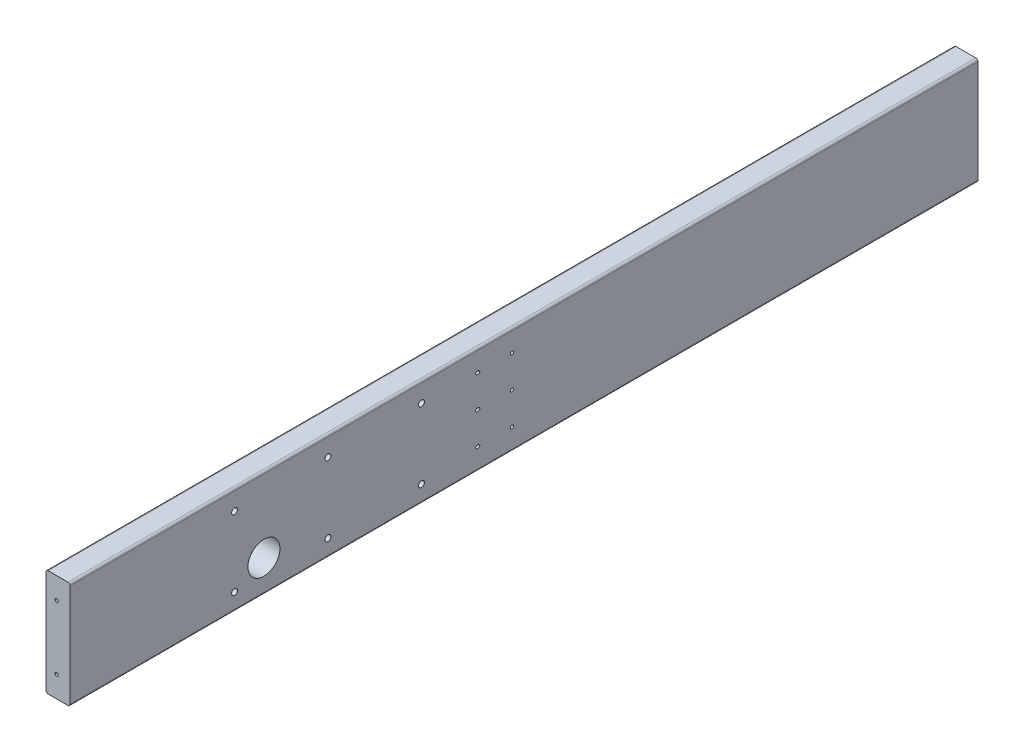
from build123d import *

# Parameters (mm, degrees)
SKETCH1_W                       = 45
SKETCH1_H                       = 200
BOSS_EXTRUDE1_DEPTH             = 1700
FILLET1_R                       = 4
SKETCH9_R                       = 30
CUT_EXTRUDE1_DEPTH              = 50
SKETCH10_R                      = 5.5
CUT_EXTRUDE2_DEPTH              = 50
SKETCH11_R                      = 5.5
CUT_EXTRUDE3_DEPTH              = 50
SKETCH12_R                      = 5.5
CUT_EXTRUDE4_DEPTH              = 50
SKETCH13_R                      = 5.5
CUT_EXTRUDE5_DEPTH              = 50
SKETCH14_R                      = 5.5
CUT_EXTRUDE6_DEPTH              = 50
SKETCH15_R                      = 5.5
CUT_EXTRUDE7_DEPTH              = 50
SKETCH16_R                      = 18
CUT_EXTRUDE8_DEPTH              = 30
F_6_0MM_DOWEL_SLOT_D            = 6
F_6_0MM_DOWEL_SLOT_DEPTH        = 128.197418143
F_6_0MM_DOWEL_SLOT_CSINK_D      = 6.05
F_6_0MM_DOWEL_SLOT_CSINK_ANGLE  = 90
F_6_0MM_DOWEL_SLOT_TIP          = 1.802581857
F_6_0MM_DOWEL_SLOT1_D           = 6
F_6_0MM_DOWEL_SLOT1_DEPTH       = 63.197418143
F_6_0MM_DOWEL_SLOT1_CSINK_D     = 6.05
F_6_0MM_DOWEL_SLOT1_CSINK_ANGLE = 90
F_6_0MM_DOWEL_SLOT1_TIP         = 1.802581857
SKETCH25_R                      = 18
CUT_EXTRUDE9_DEPTH              = 30
F_6_0MM_DOWEL_SLOT2_D           = 6
F_6_0MM_DOWEL_SLOT2_DEPTH       = 48.197418143
F_6_0MM_DOWEL_SLOT2_CSINK_D     = 6.05
F_6_0MM_DOWEL_SLOT2_CSINK_ANGLE = 90
F_6_0MM_DOWEL_SLOT2_TIP         = 1.802581857
F_8_0MM_DOWEL_SLOT4_D           = 8
F_8_0MM_DOWEL_SLOT4_DEPTH       = 137.596557524
F_8_0MM_DOWEL_SLOT4_CSINK_D     = 8.05
F_8_0MM_DOWEL_SLOT4_CSINK_ANGLE = 90
F_8_0MM_DOWEL_SLOT4_TIP         = 2.403442476


with BuildPart() as part:
    # Sketch1 → Boss-Extrude1 (new body)
    with BuildSketch(Plane.XY):
        with Locations((-8.688255411, 34.272684877)):
            Rectangle(SKETCH1_W, SKETCH1_H)
    extrude(amount=BOSS_EXTRUDE1_DEPTH)

    # Fillet1
    fillet1_edges = [part.edges().sort_by_distance(p)[0] for p in [
        (13.811744589, 134.272684877, 850),
        (13.811744589, -65.727315123, 850),
        (-31.188255411, -65.727315123, 850),
        (-31.188255411, 134.272684877, 850),
    ]]
    fillet(fillet1_edges, radius=FILLET1_R)

    # Sketch9 → Cut-Extrude1 (cut)
    with BuildSketch(Plane(origin=(13.811744589, 0, 0), x_dir=(0, 0, -1), z_dir=(1, 0, 0))):
        with Locations((-1337, -5.727315122)):
            Circle(SKETCH9_R)
    extrude(amount=-CUT_EXTRUDE1_DEPTH, mode=Mode.SUBTRACT)

    # Sketch10 → Cut-Extrude2 (cut)
    with BuildSketch(Plane(origin=(13.811744589, 0, 0), x_dir=(0, 0, -1), z_dir=(1, 0, 0))):
        with Locations((-1392, 97.272684878)):
            Circle(SKETCH10_R)
    extrude(amount=-CUT_EXTRUDE2_DEPTH, mode=Mode.SUBTRACT)

    # Sketch11 → Cut-Extrude3 (cut)
    with BuildSketch(Plane(origin=(13.811744589, 0, 0), x_dir=(0, 0, -1), z_dir=(1, 0, 0))):
        with Locations((-1392, -33.727315122)):
            Circle(SKETCH11_R)
    extrude(amount=-CUT_EXTRUDE3_DEPTH, mode=Mode.SUBTRACT)

    # Sketch12 → Cut-Extrude4 (cut)
    with BuildSketch(Plane(origin=(13.811744589, 0, 0), x_dir=(0, 0, -1), z_dir=(1, 0, 0))):
        with Locations((-1217, 97.272684878)):
            Circle(SKETCH12_R)
    extrude(amount=-CUT_EXTRUDE4_DEPTH, mode=Mode.SUBTRACT)

    # Sketch13 → Cut-Extrude5 (cut)
    with BuildSketch(Plane(origin=(13.811744589, 0, 0), x_dir=(0, 0, -1), z_dir=(1, 0, 0))):
        with Locations((-1217, -33.727315122)):
            Circle(SKETCH13_R)
    extrude(amount=-CUT_EXTRUDE5_DEPTH, mode=Mode.SUBTRACT)

    # Sketch14 → Cut-Extrude6 (cut)
    with BuildSketch(Plane(origin=(13.811744589, 0, 0), x_dir=(0, 0, -1), z_dir=(1, 0, 0))):
        with Locations((-1042, -33.727315122)):
            Circle(SKETCH14_R)
    extrude(amount=-CUT_EXTRUDE6_DEPTH, mode=Mode.SUBTRACT)

    # Sketch15 → Cut-Extrude7 (cut)
    with BuildSketch(Plane(origin=(13.811744589, 0, 0), x_dir=(0, 0, -1), z_dir=(1, 0, 0))):
        with Locations((-1042, 97.272684878)):
            Circle(SKETCH15_R)
    extrude(amount=-CUT_EXTRUDE7_DEPTH, mode=Mode.SUBTRACT)

    # Sketch16 → Cut-Extrude8 (cut)
    with BuildSketch(Plane.ZY.offset(31.188255411)):
        with Locations(Location((50, -25.727315123, 0), (0, 0, 270))):
            Circle(SKETCH16_R)
        with Locations(Location((50, 34.272684877, 0), (0, 0, 270))):
            Circle(SKETCH16_R)
        with Locations(Location((50, 91.272684877, 0), (0, 0, 270))):
            Circle(SKETCH16_R)
    extrude(amount=-CUT_EXTRUDE8_DEPTH, mode=Mode.SUBTRACT)

    # Ø6.0mm Dowel Slot
    with Locations(Plane(origin=(-854.153391206, -65.727315123, 36.0493232), x_dir=(0.6427592920058945, 7.226860248094423e-15, 0.7660682035824756), z_dir=(-0.7660682035824756, -8.613283256507993e-15, 0.6427592920058945))):
        with Locations((1247.849951753, 160), (1247.849951753, 100), (1247.849951753, 40)):
            CounterSinkHole(F_6_0MM_DOWEL_SLOT_D / 2, F_6_0MM_DOWEL_SLOT_CSINK_D / 2, depth=F_6_0MM_DOWEL_SLOT_DEPTH, counter_sink_angle=F_6_0MM_DOWEL_SLOT_CSINK_ANGLE)
            with Locations((0, 0, -(F_6_0MM_DOWEL_SLOT_DEPTH + F_6_0MM_DOWEL_SLOT_TIP / 2))):  # 118° drill point
                Cone(0, F_6_0MM_DOWEL_SLOT_D / 2, F_6_0MM_DOWEL_SLOT_TIP, mode=Mode.SUBTRACT)

    # Ø6.0mm Dowel Slot1
    with Locations(Plane(origin=(13.811744589, -65.727315123, 0), x_dir=(0, 0, -1), z_dir=(1, 0, 0))):
        with Locations((-872.5, 160), (-872.5, 100), (-872.5, 40)):
            CounterSinkHole(F_6_0MM_DOWEL_SLOT1_D / 2, F_6_0MM_DOWEL_SLOT1_CSINK_D / 2, depth=F_6_0MM_DOWEL_SLOT1_DEPTH, counter_sink_angle=F_6_0MM_DOWEL_SLOT1_CSINK_ANGLE)
            with Locations((0, 0, -(F_6_0MM_DOWEL_SLOT1_DEPTH + F_6_0MM_DOWEL_SLOT1_TIP / 2))):  # 118° drill point
                Cone(0, F_6_0MM_DOWEL_SLOT1_D / 2, F_6_0MM_DOWEL_SLOT1_TIP, mode=Mode.SUBTRACT)

    # Sketch25 → Cut-Extrude9 (cut)
    with BuildSketch(Plane.ZY.offset(31.188255411)):
        with Locations(Location((1650, 94.272684877, 0), (0, 0, 270))):
            Circle(SKETCH25_R)
        with Locations(Location((1650, -25.727315123, 0), (0, 0, 270))):
            Circle(SKETCH25_R)
    extrude(amount=-CUT_EXTRUDE9_DEPTH, mode=Mode.SUBTRACT)

    # Ø6.0mm Dowel Slot2
    with Locations(Plane(origin=(-811.188255411, -65.727315123, 1700), x_dir=(1, 0, 0), z_dir=(0, 0, 1))):
        with Locations((25, 160), (25, 40), (800, 160), (800, 40)):
            CounterSinkHole(F_6_0MM_DOWEL_SLOT2_D / 2, F_6_0MM_DOWEL_SLOT2_CSINK_D / 2, depth=F_6_0MM_DOWEL_SLOT2_DEPTH, counter_sink_angle=F_6_0MM_DOWEL_SLOT2_CSINK_ANGLE)
            with Locations((0, 0, -(F_6_0MM_DOWEL_SLOT2_DEPTH + F_6_0MM_DOWEL_SLOT2_TIP / 2))):  # 118° drill point
                Cone(0, F_6_0MM_DOWEL_SLOT2_D / 2, F_6_0MM_DOWEL_SLOT2_TIP, mode=Mode.SUBTRACT)

    # Ø8.0mm Dowel Slot4
    with Locations(Plane(origin=(-811.188255411, -65.727315123, -90), x_dir=(-1, 0, 0), z_dir=(0, 0, -1))):
        with Locations((-802.5, 40), (-802.5, 100), (-802.5, 157)):
            CounterSinkHole(F_8_0MM_DOWEL_SLOT4_D / 2, F_8_0MM_DOWEL_SLOT4_CSINK_D / 2, depth=F_8_0MM_DOWEL_SLOT4_DEPTH, counter_sink_angle=F_8_0MM_DOWEL_SLOT4_CSINK_ANGLE)
            with Locations((0, 0, -(F_8_0MM_DOWEL_SLOT4_DEPTH + F_8_0MM_DOWEL_SLOT4_TIP / 2))):  # 118° drill point
                Cone(0, F_8_0MM_DOWEL_SLOT4_D / 2, F_8_0MM_DOWEL_SLOT4_TIP, mode=Mode.SUBTRACT)


solid = part.part
